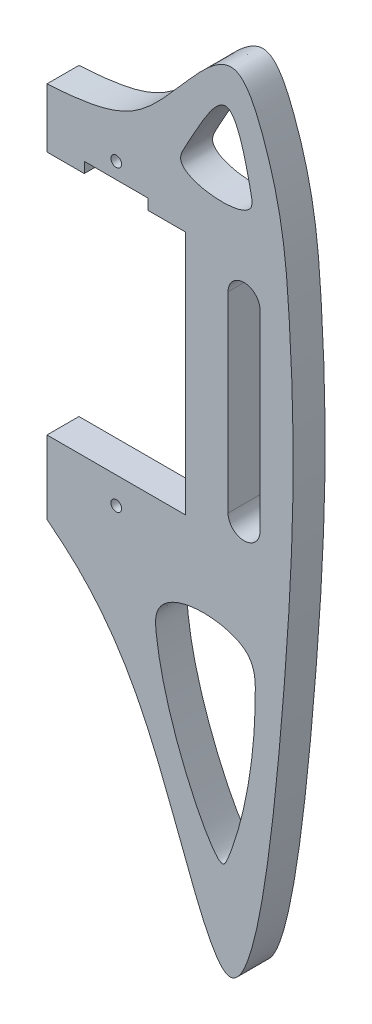
from build123d import *

# Parameters (mm, degrees)
SKETCH1_R           = 0.5
BOSS_EXTRUDE1_DEPTH = 3
SKETCH2_W           = 6
SKETCH2_H           = 1
BOSS_EXTRUDE2_DEPTH = 3
CUT_EXTRUDE1_DEPTH  = 5
CUT_EXTRUDE2_REACH  = 45.552
SKETCH4_W           = 6
SKETCH4_H           = 2
CUT_EXTRUDE3_DEPTH  = 5
CUT_EXTRUDE4_DEPTH  = 5
CUT_EXTRUDE5_DEPTH  = 5


with BuildPart() as part:
    # Sketch1 → Boss-Extrude1 (new body)
    with BuildSketch(Plane.XY):
        with BuildLine():
            Line((-11.5, 29.989165774), (-11.5, -2.003043722))
            add(Edge.make_bspline(
                [(-11.5, 29.989165774), (0.931030808, 30.143995551), (1.864813943, 31.536255842), (11.182575778, 42.099820492), (15.463537913, 32.612573352), (16.827490587, 16.749830903), (16.812030607, -1.665613496), (11.9215419, -45.354719591), (2.80112045, -13.047539172), (-4.522328652, -6.075264795), (-11.5, -2.003043722)],
                knots=[0, 0, 0, 0, 0.137544887, 0.178055892, 0.211383703, 0.308423562, 0.542419526, 0.718101877, 0.845348698, 1, 1, 1, 1], degree=3))
        make_face()
        with Locations((0, 27.090526311)):
            Circle(SKETCH1_R, mode=Mode.SUBTRACT)
        with Locations((0, -0.909473689)):
            Circle(SKETCH1_R, mode=Mode.SUBTRACT)
        Polygon((-6.5, 24.590526311), (6.5, 24.590526311), (6.5, 1.590526311), (3, 1.590526311), (3, 0.590526311), (-3, 0.590526311), (-3, 1.590526311), (-6.5, 1.590526311), align=None, mode=Mode.SUBTRACT)
    extrude(amount=BOSS_EXTRUDE1_DEPTH)

    # Sketch2 → Boss-Extrude2 (add)
    with BuildSketch(Plane.XY.offset(3)):
        with Locations((0, 1.090526311)):
            Rectangle(SKETCH2_W, SKETCH2_H)
    extrude(amount=-BOSS_EXTRUDE2_DEPTH)

    # Sketch3 → Cut-Extrude1 (cut)
    with BuildSketch(Plane.XY.offset(3)):
        with BuildLine():
            Line((-6.5, 1.590526311), (-6.5, 24.590526311))
            Line((-6.5, 24.590526311), (-6.5, 30.141031267))
            add(Edge.make_bspline(
                [(-6.5, 30.141031267), (-7.924178407, 30.059380897), (-9.571124682, 30.013190116), (-11.5, 29.989165774)],
                knots=[0.978657688, 0.978657688, 0.978657688, 0.978657688, 1, 1, 1, 1], degree=3))
            Line((-11.5, 29.989165774), (-11.5, -2.003043722))
            add(Edge.make_bspline(
                [(-11.5, -2.003043722), (-9.638067376, -3.089681496), (-7.986898061, -4.158718816), (-6.5, -5.288798109)],
                knots=[0, 0, 0, 0, 0.041267393, 0.041267393, 0.041267393, 0.041267393], degree=3))
            Line((-6.5, -5.288798109), (-6.5, 1.590526311))
        make_face()
    extrude(amount=-CUT_EXTRUDE1_DEPTH, mode=Mode.SUBTRACT)

    # Sketch4 → Cut-Extrude2 (cut, up to next)
    with BuildSketch(Plane.XY.offset(3), mode=Mode.PRIVATE) as cut_extrude2_sk1:
        with Locations((0, 24.590526311)):
            Rectangle(SKETCH4_W, SKETCH4_H)
    cut_extrude2_tool1 = extrude(cut_extrude2_sk1.sketch, amount=-CUT_EXTRUDE2_REACH, mode=Mode.PRIVATE) & part.part
    add(cut_extrude2_tool1.solids().sort_by_distance((0, 24.590526, 3))[0], mode=Mode.SUBTRACT)

    # Sketch6 → Cut-Extrude3 (cut)
    with BuildSketch(Plane.XY.offset(3)):
        with BuildLine():
            add(Edge.make_bspline(
                [(3.75939202, -9.444776583), (4.514374253, -15.985306292), (9.526047536, -26.305767082), (11.195467528, -23.036137571), (13.302662578, -15.673667164), (12.946866156, -5.004183865), (3.367871771, -4.988472744), (3.707349313, -8.993922436), (3.75939202, -9.444776583)],
                knots=[0, 0, 0, 0, 0.250915666, 0.333619457, 0.772213638, 0.844334119, 0.982703791, 1, 1, 1, 1], degree=3))
        make_face()
    extrude(amount=-CUT_EXTRUDE3_DEPTH, mode=Mode.SUBTRACT)

    # Sketch8 → Cut-Extrude4 (cut)
    with BuildSketch(Plane.XY.offset(3)):
        with BuildLine():
            Line((13.5, 21.73881832), (13.5, 3.73881832))
            ThreePointArc((13.5, 3.73881832), (12, 2.23881832), (10.5, 3.73881832))
            Line((10.5, 3.73881832), (10.5, 21.73881832))
            ThreePointArc((10.5, 21.73881832), (12, 23.23881832), (13.5, 21.73881832))
        make_face()
    extrude(amount=-CUT_EXTRUDE4_DEPTH, mode=Mode.SUBTRACT)

    # Sketch9 → Cut-Extrude5 (cut)
    with BuildSketch(Plane.XY.offset(3)):
        with BuildLine():
            add(Edge.make_bspline(
                [(10.37288169, 36.696303363), (11.393815381, 36.458952089), (12.271969994, 32.696452749), (13.220521781, 28.073172196), (4.873727326, 28.772258673), (7.64063538, 33.523971801), (9.315195003, 36.942199139), (10.37288169, 36.696303363)],
                knots=[0, 0, 0, 0, 0.300499947, 0.365909084, 0.62207112, 0.688682237, 1, 1, 1, 1], degree=3))
        make_face()
    extrude(amount=-CUT_EXTRUDE5_DEPTH, mode=Mode.SUBTRACT)


solid = part.part
